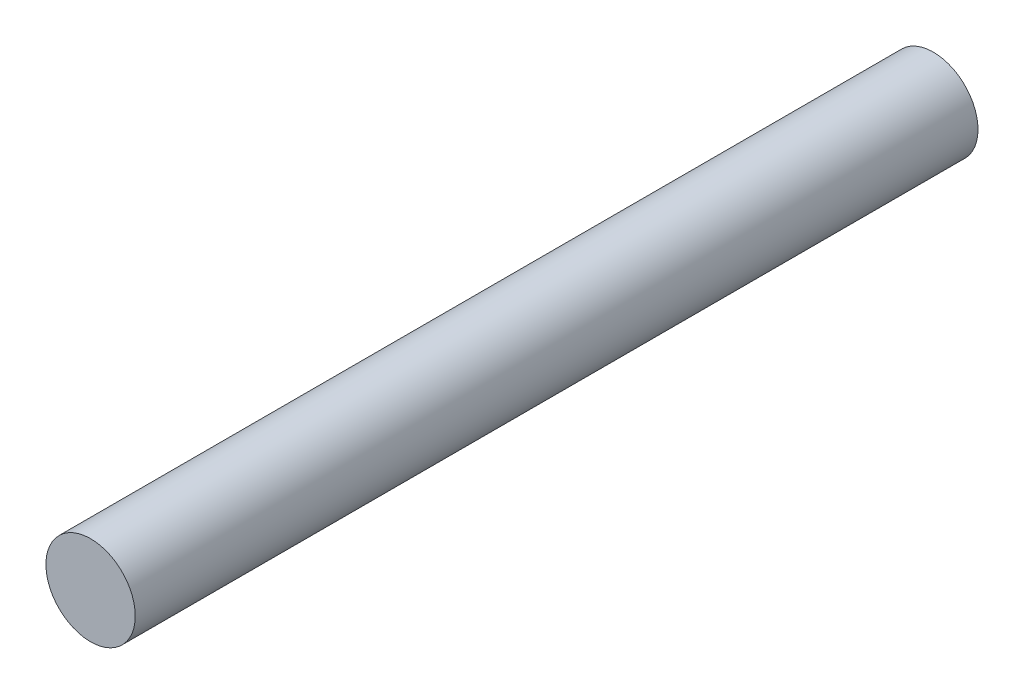
from build123d import *

# Parameters (mm, degrees)
SKETCH1_R           = 15.9
BOSS_EXTRUDE1_DEPTH = 300


with BuildPart() as part:
    # Sketch1 → Boss-Extrude1 (new body)
    with BuildSketch(Plane.XY):
        Circle(SKETCH1_R)
    extrude(amount=BOSS_EXTRUDE1_DEPTH)


solid = part.part
